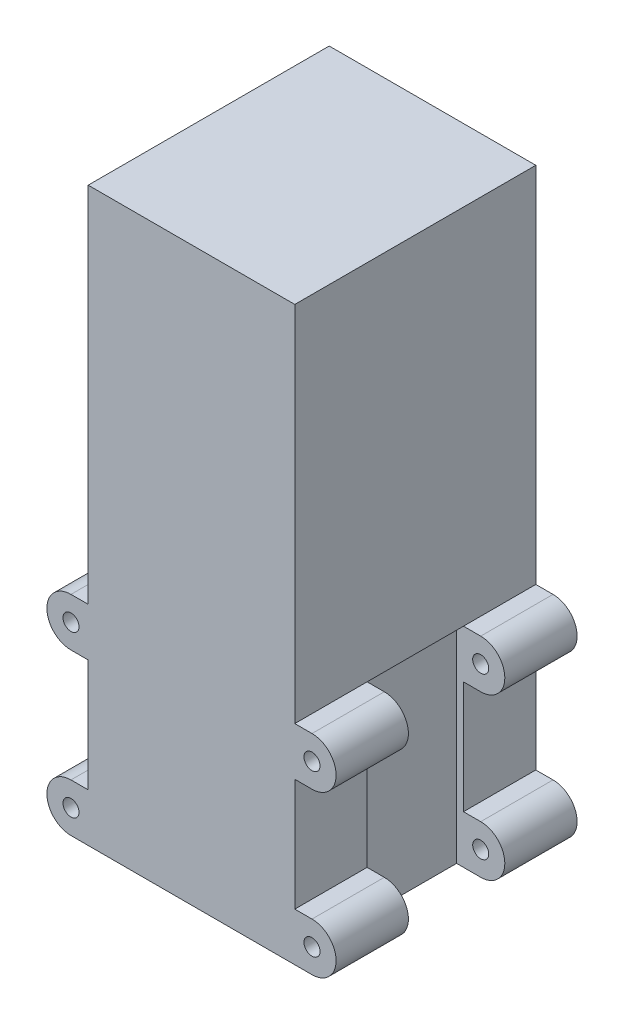
from build123d import *

# Parameters (mm, degrees)
SKETCH_1_R          = 1
EXTRUDE_1_DEPTH     = 30
CUT_EXTRUDE_1_REACH = 81.318
SKETCH_2_W          = 6
SKETCH_2_H          = 12


with BuildPart() as part:
    # Эскиз1 → Бобышка-Вытянуть1 (new body)
    with BuildSketch(Plane.XY):
        with BuildLine():
            Line((-15, 20), (-12.857189373, 20))
            Line((-12.857189373, 20), (-12.857189373, 6))
            Line((-12.857189373, 6), (-15, 6))
            ThreePointArc((-15, 6), (-18, 3), (-15, 0))
            Line((-15, 0), (0, 0))
            Line((0, 0), (0, 55.160876672))
            Line((0, 55.160876672), (0, 71.184974766))
            Line((0, 71.184974766), (-12.857189373, 71.184974766))
            Line((-12.857189373, 71.184974766), (-12.857189373, 26))
            Line((-12.857189373, 26), (-15, 26))
            ThreePointArc((-15, 26), (-18, 23), (-15, 20))
        make_face()
        with Locations((-15, 23)):
            Circle(SKETCH_1_R, mode=Mode.SUBTRACT)
        with Locations((-15, 3)):
            Circle(SKETCH_1_R, mode=Mode.SUBTRACT)
    extrude_1 = extrude(amount=-EXTRUDE_1_DEPTH)

    # Вырез-Вытянуть1: up to this face of the body (flat: up to its plane)
    cut_extrude_1_end = Plane(part.part.faces().sort_by_distance((-13.928594687, 26, -15))[0])
    # Эскиз2 → Вырез-Вытянуть1 (cut, up to the picked face)
    with BuildSketch(Plane(origin=(0, 0, 0), x_dir=(1, 0, 0), z_dir=(0, 1, 0)), mode=Mode.PRIVATE) as cut_extrude_1_sk1:
        with Locations((-15, 15)):
            Rectangle(SKETCH_2_W, SKETCH_2_H)
    cut_extrude_1_tool1 = split(extrude(cut_extrude_1_sk1.sketch, amount=CUT_EXTRUDE_1_REACH, mode=Mode.PRIVATE), bisect_by=cut_extrude_1_end, keep=Keep.BOTH, mode=Mode.PRIVATE)
    cut_extrude_1 = cut_extrude_1_tool1.solids().sort_by(Axis((-15, 0, -15), (0, 1, 0)))[0]
    add(cut_extrude_1, mode=Mode.SUBTRACT)

    # Зеркальное отражение1: Бобышка-Вытянуть1, Вырез-Вытянуть1 across plane
    add(extrude_1.mirror(Plane(origin=(0, 71.184974766, -30), x_dir=(0, 0, 1), z_dir=(1, 0, 0))))
    add(cut_extrude_1.mirror(Plane(origin=(0, 71.184974766, -30), x_dir=(0, 0, 1), z_dir=(1, 0, 0))), mode=Mode.SUBTRACT)


solid = part.part
